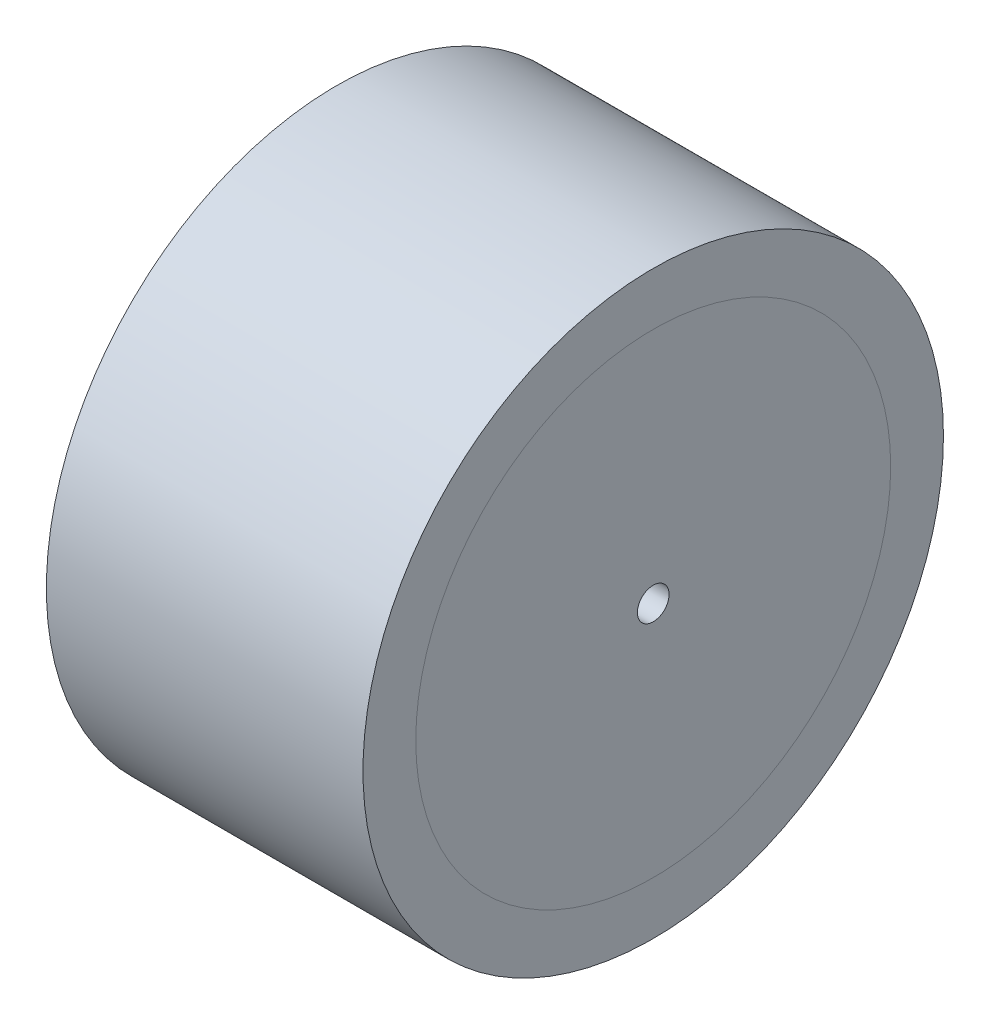
from build123d import *

# Parameters (mm, degrees)
SKETCH1_R           = 27.5
BOSS_EXTRUDE1_DEPTH = 30
SKETCH2_R           = 1.5
CUT_EXTRUDE1_DEPTH  = 50.117206761


with BuildPart() as part:
    # Sketch1 → Boss-Extrude1 (new body)
    with BuildSketch(Plane(origin=(0, 0, 0), x_dir=(0, 0, -1), z_dir=(1, 0, 0))):
        Circle(SKETCH1_R)
    extrude(amount=BOSS_EXTRUDE1_DEPTH)

    # Sketch2 → Cut-Extrude1 (cut, through all)
    with BuildSketch(Plane.ZY):
        Circle(SKETCH2_R)
    extrude(amount=-CUT_EXTRUDE1_DEPTH, mode=Mode.SUBTRACT)


solid = part.part
